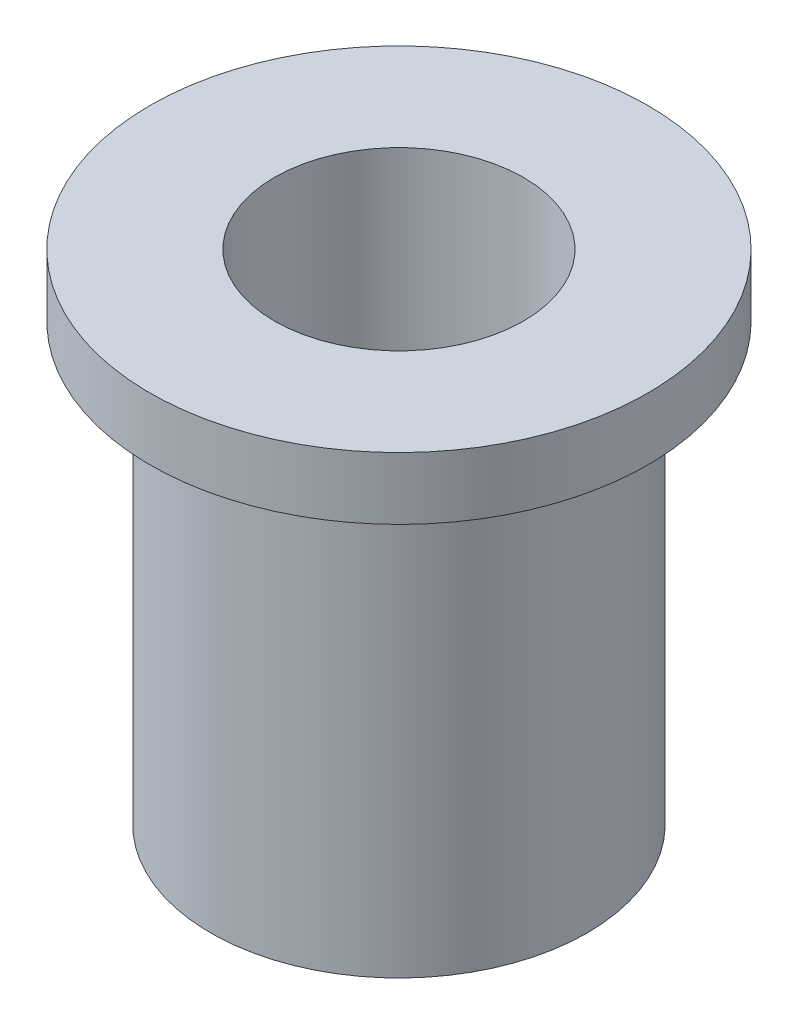
from build123d import *


with BuildPart() as part:
    # Sketch1 → Revolve1 (revolve)
    with BuildSketch(Plane.XY, mode=Mode.PRIVATE) as revolve1_sk:
        Polygon((8.617134939, -14.91189475), (8.617134939, -27.61189475), (10.242734939, -27.61189475), (10.242734939, -16.49939475), (11.792134939, -16.49939475), (11.792134939, -14.91189475), align=None)
    revolve(revolve1_sk.sketch.rotate(Axis((5.442134939, 36.321687054, 0), (0, -1, 0)), 180), axis=Axis((5.442134939, 36.321687054, 0), (0, -1, 0)))


solid = part.part
